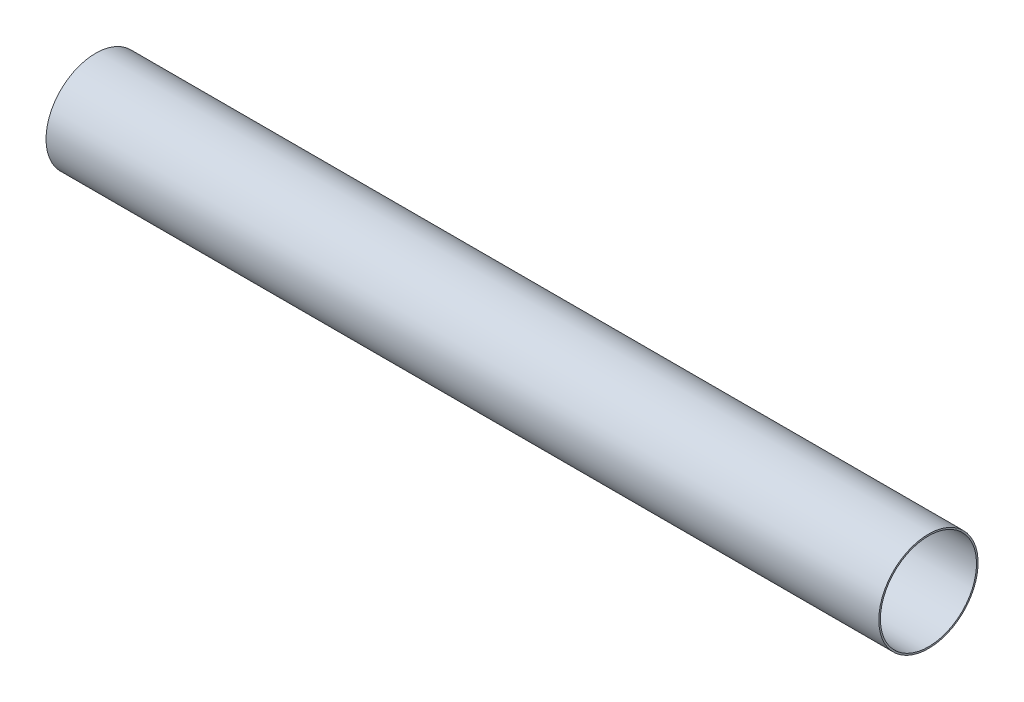
from build123d import *

# Parameters (mm, degrees)
ESQUISSE1_W = 1300
ESQUISSE1_H = 2.47


with BuildPart() as part:
    # Esquisse1 → Révolution1 (revolve)
    with BuildSketch(Plane.XY, mode=Mode.PRIVATE) as r_volution1_sk:
        with Locations((650, 76.235)):
            Rectangle(ESQUISSE1_W, ESQUISSE1_H)
    revolve(r_volution1_sk.sketch.rotate(Axis((0, 0, 0), (1, 0, 0)), 90), axis=Axis((0, 0, 0), (1, 0, 0)))


solid = part.part
